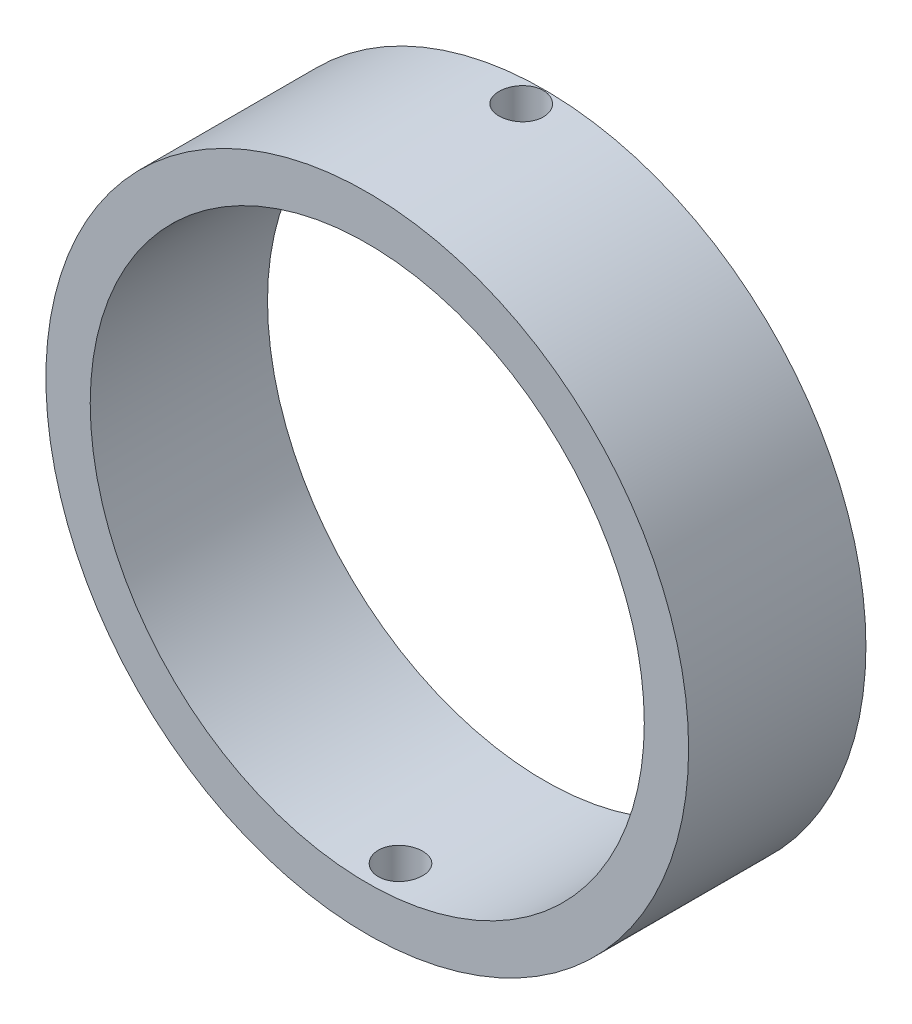
from build123d import *

# Parameters (mm, degrees)
SKETCH1_R           = 29
SKETCH1_R_2         = 25
BOSS_EXTRUDE1_DEPTH = 16
SKETCH3_R           = 2
CUT_EXTRUDE1_DEPTH  = 16
SKETCH4_R           = 2
CUT_EXTRUDE2_DEPTH  = 16


with BuildPart() as part:
    # Sketch1 → Boss-Extrude1 (new body)
    with BuildSketch(Plane.XY):
        Circle(SKETCH1_R)
        Circle(SKETCH1_R_2, mode=Mode.SUBTRACT)
    extrude(amount=BOSS_EXTRUDE1_DEPTH)

    # Sketch3 → Cut-Extrude1 (cut)
    with BuildSketch(Plane(origin=(0, 29, 0), x_dir=(1, 0, 0), z_dir=(0, 1, 0))):
        with Locations(Location((0, -2.108912796, 0), (0, 0, 270))):
            Circle(SKETCH3_R)
    extrude(amount=-CUT_EXTRUDE1_DEPTH, mode=Mode.SUBTRACT)

    # Sketch4 → Cut-Extrude2 (cut)
    with BuildSketch(Plane(origin=(0, -29, 0), x_dir=(1, 0, 0), z_dir=(0, 1, 0))):
        with Locations(Location((0, -13, 0), (0, 0, 90))):
            Circle(SKETCH4_R)
    extrude(amount=CUT_EXTRUDE2_DEPTH, mode=Mode.SUBTRACT)


solid = part.part
